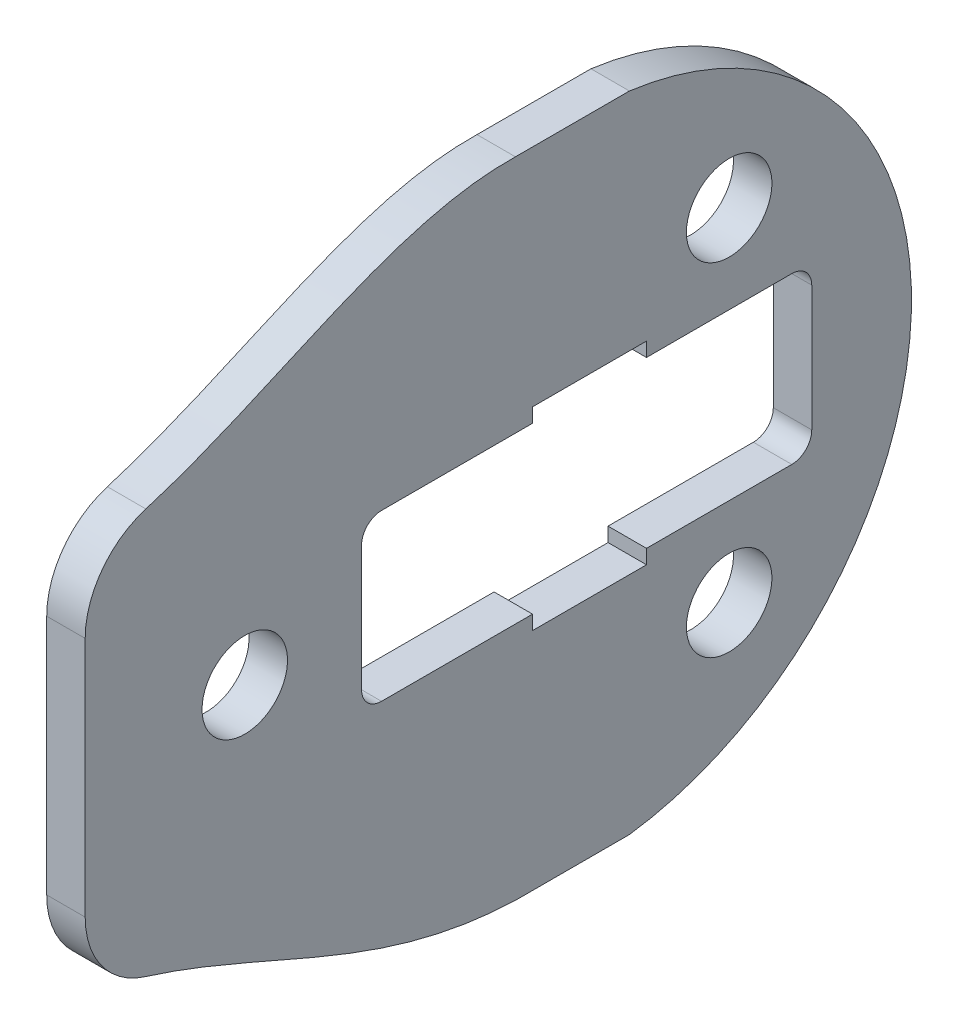
from build123d import *

# Parameters (mm, degrees)
SCHIZZO1_R                   = 1.5
ESTRUSIONE_ESTRUSIONE1_DEPTH = 1.35
RACCORDO2_R                  = 3
RACCORDO3_R                  = 3
RACCORDO4_R                  = 0.7


with BuildPart() as part:
    # Schizzo1 → Estrusione-Estrusione1 (new body)
    with BuildSketch(Plane(origin=(0, 0, 0), x_dir=(0, 0, -1), z_dir=(1, 0, 0))):
        with BuildLine():
            add(Edge.make_bspline(
                [(-7.501010101, -10.3), (-10.845030199, -9.13986581), (-13.865102381, -7.304364218), (-17.601010101, -6.594005849)],
                knots=[0.271280726, 0.271280726, 0.271280726, 0.271280726, 0.852483684, 0.852483684, 0.852483684, 0.852483684], degree=3))
            add(Edge.make_bspline(
                [(-2.501010101, -11.3), (-4.308742426, -11.235865063), (-5.940164296, -10.841501107), (-7.501010101, -10.3)],
                knots=[0, 0, 0, 0, 0.271280726, 0.271280726, 0.271280726, 0.271280726], degree=3))
            Line((-2.501010101, -11.3), (1.498989899, -11.3))
            ThreePointArc((1.498989899, -11.3), (11.398989899, 0), (1.498989899, 11.3))
            Line((1.498989899, 11.3), (-2.501010101, 11.3))
            add(Edge.make_bspline(
                [(-2.501010101, 11.3), (-4.209338931, 11.338090952), (-5.850739142, 10.914740779), (-7.501010101, 10.3)],
                knots=[0, 0, 0, 0, 0.293888871, 0.293888871, 0.293888871, 0.293888871], degree=3))
            add(Edge.make_bspline(
                [(-7.501010101, 10.3), (-10.658273676, 9.123890914), (-13.848006436, 7.247243694), (-17.601010101, 6.561146452)],
                knots=[0.293888871, 0.293888871, 0.293888871, 0.293888871, 0.856150858, 0.856150858, 0.856150858, 0.856150858], degree=3))
            Line((-17.601010101, 6.561146452), (-17.601010101, 0))
            Line((-17.601010101, 0), (-17.601010101, -6.594005849))
        make_face()
        with Locations(Location((5, -6, 0), (0, 0, 180))):
            Circle(SCHIZZO1_R, mode=Mode.SUBTRACT)
        with BuildLine():
            ThreePointArc((-10.5, 0), (-12, -1.5), (-13.5, 0))
            ThreePointArc((-13.5, 0), (-12, 1.5), (-10.5, 0))
        make_face(mode=Mode.SUBTRACT)
        Polygon((-7.9, -2.9), (-7.9, 0), (-7.9, 2.9), (-1.901010101, 2.9), (-1.901010101, 3.4), (2.098989899, 3.4), (2.098989899, 2.9), (7.898989899, 2.9), (7.898989899, -2.9), (2.098989899, -2.9), (2.098989899, -3.4), (-1.901010101, -3.4), (-1.901010101, -2.9), align=None, mode=Mode.SUBTRACT)
        with Locations(Location((5, 6, 0), (0, 0, 180))):
            Circle(SCHIZZO1_R, mode=Mode.SUBTRACT)
    extrude(amount=ESTRUSIONE_ESTRUSIONE1_DEPTH)

    # Raccordo2
    raccordo2_edges = [part.edges().sort_by_distance(p)[0] for p in [
        (0.675, -6.594005849, 17.601010101),
    ]]
    fillet(raccordo2_edges, radius=RACCORDO2_R)

    # Raccordo3
    raccordo3_edges = [part.edges().sort_by_distance(p)[0] for p in [
        (0.675, 6.561146452, 17.601010101),
    ]]
    fillet(raccordo3_edges, radius=RACCORDO3_R)

    # Raccordo4
    raccordo4_edges = [part.edges().sort_by_distance(p)[0] for p in [
        (0.675, -2.9, -7.898989899),
        (0.675, 2.9, -7.898989899),
        (0.675, 2.9, 7.9),
        (0.675, -2.9, 7.9),
    ]]
    fillet(raccordo4_edges, radius=RACCORDO4_R)


solid = part.part
